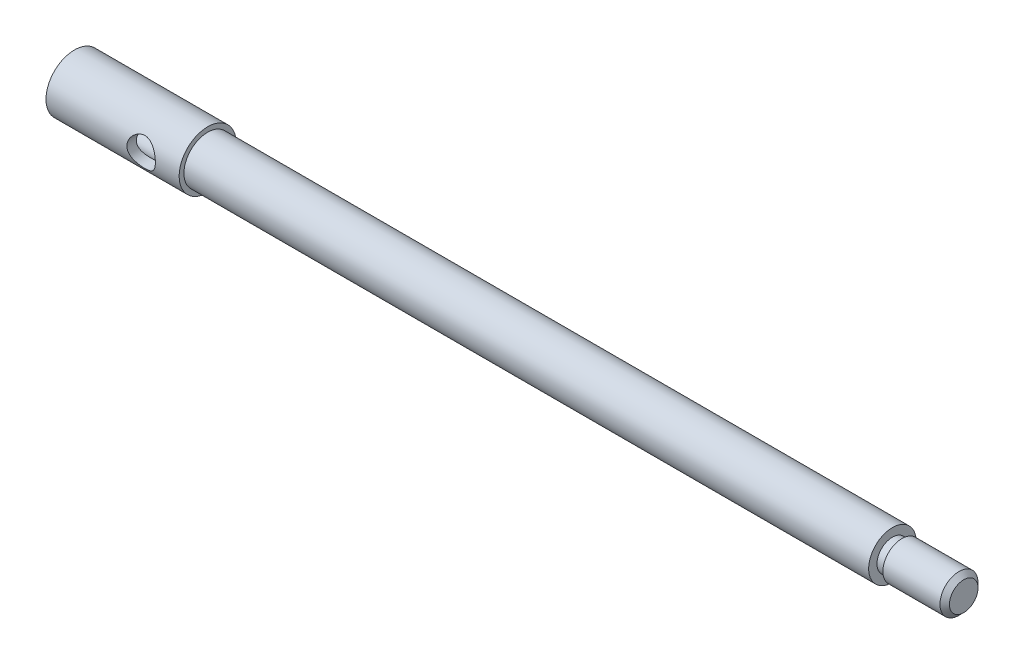
from build123d import *

# Parameters (mm, degrees)
SKETCH_3_R               = 4
EXTRUDE_1_DEPTH          = 13
SKETCH_5_R               = 3.25
EXTRUDE_2_DEPTH          = 2
SKETCH_6_R               = 5
EXTRUDE_3_DEPTH          = 144
CHAMFER_2_SIZE           = 1
SKETCH_69_R              = 6
EXTRUDE_4_DEPTH          = 28
HOLE_WIZARD_1_D          = 8
HOLE_WIZARD_1_DEPTH      = 25
HOLE_WIZARD_1_TIP        = 2.403442476
CUT_EXTRUDE_1_DEPTH      = 28
CUT_EXTRUDE_1_DEPTH_BACK = 28
SKETCH_70_R              = 3


with BuildPart() as part:
    # 草图3 → 凸台-拉伸1 (new body)
    with BuildSketch(Plane(origin=(0, 0, 0), x_dir=(0, 0, -1), z_dir=(1, 0, 0))):
        Circle(SKETCH_3_R)
    extrude(amount=-EXTRUDE_1_DEPTH)

    # 草图5 → 凸台-拉伸2 (add)
    with BuildSketch(Plane.ZY.offset(13)):
        Circle(SKETCH_5_R)
    extrude(amount=EXTRUDE_2_DEPTH)

    # 草图6 → 凸台-拉伸3 (add)
    with BuildSketch(Plane.ZY.offset(15)):
        Circle(SKETCH_6_R)
    extrude(amount=EXTRUDE_3_DEPTH)

    # 倒角2
    chamfer_2_edges = [part.edges().sort_by_distance(p)[0] for p in [
        (0, 0, 4),
    ]]
    chamfer(chamfer_2_edges, length=CHAMFER_2_SIZE)

    # 草图69 → 凸台-拉伸4 (add)
    with BuildSketch(Plane.ZY.offset(159)):
        Circle(SKETCH_69_R)
    extrude(amount=EXTRUDE_4_DEPTH)

    # 孔1
    with Locations(Plane.ZY.offset(187)):
        with Locations((0, 0)):
            Hole(HOLE_WIZARD_1_D / 2, depth=HOLE_WIZARD_1_DEPTH)
            with Locations((0, 0, -(HOLE_WIZARD_1_DEPTH + HOLE_WIZARD_1_TIP / 2))):  # 118° drill point
                Cone(0, HOLE_WIZARD_1_D / 2, HOLE_WIZARD_1_TIP, mode=Mode.SUBTRACT)

    # 草图70 → 切除-拉伸1 (cut, two sides: drawn at the far end of the back side and taken through both)
    with BuildSketch(Plane.XY.offset(-CUT_EXTRUDE_1_DEPTH_BACK)):
        with Locations((-167, 0)):
            Circle(SKETCH_70_R)
    extrude(amount=CUT_EXTRUDE_1_DEPTH + CUT_EXTRUDE_1_DEPTH_BACK, mode=Mode.SUBTRACT)


solid = part.part
